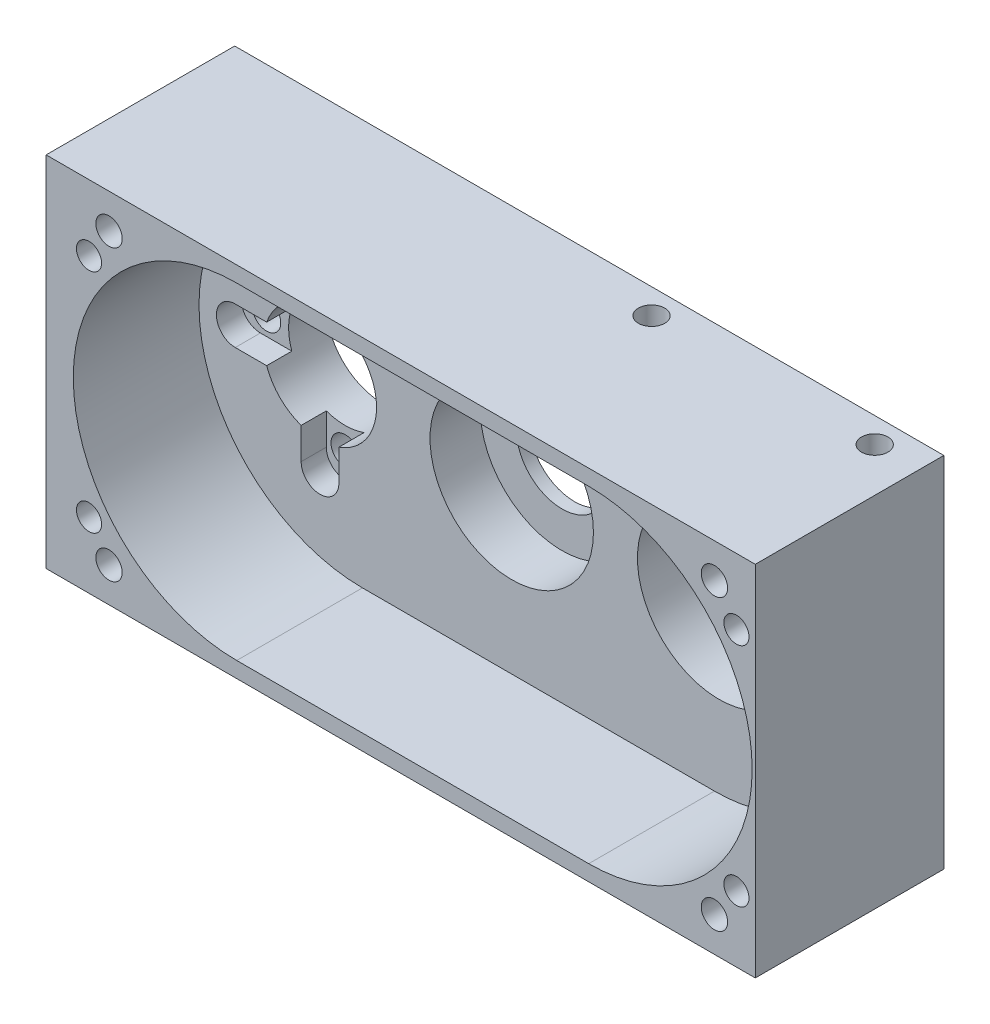
from build123d import *

# Parameters (mm, degrees)
ESBO_O1_W                                   = 118
ESBO_O1_H                                   = 62
RESSALTO_EXTRUS_O1_DEPTH                    = 30
CORTE_EXTRUS_O1_DEPTH                       = 20
RESSALTO_EXTRUS_O2_START                    = 8
RESSALTO_EXTRUS_O2_DEPTH                    = 8
ESBO_O4_R                                   = 9
ESBO_O4_R_2                                 = 13
CORTE_EXTRUS_O2_DEPTH                       = 8
ESBO_O5_R                                   = 2
CORTE_EXTRUS_O3_DEPTH                       = 8
CORTE_EXTRUS_O4_DEPTH                       = 4
BROCA_DE_ROSQUEAR_PARA_TARRAXA_DE_M52_D     = 4.2
BROCA_DE_ROSQUEAR_PARA_TARRAXA_DE_M52_DEPTH = 13
BROCA_DE_ROSQUEAR_PARA_TARRAXA_DE_M52_TIP   = 1.2618073
FURO_COM_FOLGA_DE_M41_D                     = 4.5
ESBO_O17_W                                  = 118
ESBO_O17_H                                  = 62
ESBO_O17_W_2                                = 112.82
ESBO_O17_H_2                                = 57
CORTE_EXTRUS_O5_DEPTH                       = 77.560841819
BROCA_DE_ROSQUEAR_PARA_TARRAXA_DE_M54_D     = 4.2
BROCA_DE_ROSQUEAR_PARA_TARRAXA_DE_M54_DEPTH = 15
BROCA_DE_ROSQUEAR_PARA_TARRAXA_DE_M54_TIP   = 1.2618073
BROCA_DE_ROSQUEAR_PARA_TARRAXA_DE_M55_D     = 4.2
BROCA_DE_ROSQUEAR_PARA_TARRAXA_DE_M55_DEPTH = 15
BROCA_DE_ROSQUEAR_PARA_TARRAXA_DE_M55_TIP   = 1.2618073
ESBO_O25_R                                  = 9
CORTE_EXTRUS_O6_DEPTH                       = 69.29211155
BROCA_DE_ROSQUEAR_PARA_TARRAXA_DE_M56_D     = 4.2
BROCA_DE_ROSQUEAR_PARA_TARRAXA_DE_M56_DEPTH = 8
BROCA_DE_ROSQUEAR_PARA_TARRAXA_DE_M56_TIP   = 1.2618073
FURO_COM_FOLGA_DE_M51_D                     = 5.5
ESBO_O30_R                                  = 7.25
CORTE_EXTRUS_O9_DEPTH                       = 10


with BuildPart() as part:
    # Esboço1 → Ressalto-extrusão1 (new body)
    with BuildSketch(Plane.XY):
        with Locations((4.25, 0)):
            Rectangle(ESBO_O1_W, ESBO_O1_H)
    extrude(amount=RESSALTO_EXTRUS_O1_DEPTH)

    # Esboço2 → Corte-extrusão1 (cut)
    with BuildSketch(Plane.XY.offset(30)):
        with BuildLine():
            Line((-23.75, 26), (32.25, 26))
            ThreePointArc((32.25, 26), (58.25, 0), (32.25, -26))
            Line((32.25, -26), (-23.75, -26))
            ThreePointArc((-23.75, -26), (-49.75, 0), (-23.75, 26))
        make_face()
    extrude(amount=-CORTE_EXTRUS_O1_DEPTH, mode=Mode.SUBTRACT)

    # Esboço3 → Ressalto-extrusão2 (add)
    with BuildSketch(Plane.XY.offset(10).offset(RESSALTO_EXTRUS_O2_START)):
        with BuildLine():
            Line((51, 18.012148678), (51, -18.012148678))
            ThreePointArc((51, -18.012148678), (58.25, 0), (51, 18.012148678))
        make_face()
    extrude(amount=-RESSALTO_EXTRUS_O2_DEPTH)

    # Esboço4 → Corte-extrusão2 (cut)
    with BuildSketch(Plane.XY.offset(10)):
        with Locations((-30.5, 0)):
            Circle(ESBO_O4_R)
        Circle(ESBO_O4_R_2)
        with Locations((33, 0)):
            Circle(ESBO_O4_R_2)
    extrude(amount=-CORTE_EXTRUS_O2_DEPTH, mode=Mode.SUBTRACT)

    # Esboço5 → Corte-extrusão3 (cut)
    with BuildSketch(Plane.XY.offset(30)):
        with Locations((-47.25, 18)):
            Circle(ESBO_O5_R)
        with Locations((55.75, 18)):
            Circle(ESBO_O5_R)
        with Locations((55.75, -18)):
            Circle(ESBO_O5_R)
        with Locations((-47.25, -18)):
            Circle(ESBO_O5_R)
    extrude(amount=-CORTE_EXTRUS_O3_DEPTH, mode=Mode.SUBTRACT)

    # Esboço6 → Corte-extrusão4 (cut)
    with BuildSketch(Plane.XY.offset(10)):
        with BuildLine():
            Line((-38.985281374, 3), (-43.985281374, 3))
            ThreePointArc((-43.985281374, 3), (-46.985281374, 0), (-43.985281374, -3))
            Line((-43.985281374, -3), (-38.985281374, -3))
            Line((-38.985281374, -3), (-38.985281374, 3))
        make_face()
        with BuildLine():
            Line((-33.5, 8.485281374), (-27.5, 8.485281374))
            Line((-27.5, 8.485281374), (-27.5, 13.485281374))
            ThreePointArc((-27.5, 13.485281374), (-30.5, 16.485281374), (-33.5, 13.485281374))
            Line((-33.5, 13.485281374), (-33.5, 8.485281374))
        make_face()
        with BuildLine():
            Line((-33.5, -8.485281374), (-33.5, -13.485281374))
            ThreePointArc((-33.5, -13.485281374), (-30.5, -16.485281374), (-27.5, -13.485281374))
            Line((-27.5, -13.485281374), (-27.5, -8.485281374))
            Line((-27.5, -8.485281374), (-33.5, -8.485281374))
        make_face()
    extrude(amount=-CORTE_EXTRUS_O4_DEPTH, mode=Mode.SUBTRACT)

    # Broca de rosquear para tarraxa de M52
    with Locations(Plane.XY.offset(30)):
        with Locations((-44.07, 23), (-44.07, -23), (52.25, -23), (52.25, 23)):
            Hole(BROCA_DE_ROSQUEAR_PARA_TARRAXA_DE_M52_D / 2, depth=BROCA_DE_ROSQUEAR_PARA_TARRAXA_DE_M52_DEPTH)
            with Locations((0, 0, -(BROCA_DE_ROSQUEAR_PARA_TARRAXA_DE_M52_DEPTH + BROCA_DE_ROSQUEAR_PARA_TARRAXA_DE_M52_TIP / 2))):  # 118° drill point
                Cone(0, BROCA_DE_ROSQUEAR_PARA_TARRAXA_DE_M52_D / 2, BROCA_DE_ROSQUEAR_PARA_TARRAXA_DE_M52_TIP, mode=Mode.SUBTRACT)

    # Furo com folga de M41 (through all)
    with Locations(Plane.XY.offset(6)):
        with Locations((-30.5, -12.5), (-43, 0), (-30.5, 12.5)):
            Hole(FURO_COM_FOLGA_DE_M41_D / 2)

    # Esboço17 → Corte-extrusão5 (cut, through all)
    with BuildSketch(Plane.XY.offset(30)):
        with Locations((4.25, 0)):
            Rectangle(ESBO_O17_W, ESBO_O17_H)
        with Locations((2.34, 0)):
            Rectangle(ESBO_O17_W_2, ESBO_O17_H_2, mode=Mode.SUBTRACT)
    extrude(amount=-CORTE_EXTRUS_O5_DEPTH, mode=Mode.SUBTRACT)

    # Broca de rosquear para tarraxa de M54
    with Locations(Plane(origin=(0, -28.5, 0), x_dir=(-1, 0, 0), z_dir=(0, -1, 0))):
        with Locations((-51.75, -4), (-16.25, -4)):
            Hole(BROCA_DE_ROSQUEAR_PARA_TARRAXA_DE_M54_D / 2, depth=BROCA_DE_ROSQUEAR_PARA_TARRAXA_DE_M54_DEPTH)
            with Locations((0, 0, -(BROCA_DE_ROSQUEAR_PARA_TARRAXA_DE_M54_DEPTH + BROCA_DE_ROSQUEAR_PARA_TARRAXA_DE_M54_TIP / 2))):  # 118° drill point
                Cone(0, BROCA_DE_ROSQUEAR_PARA_TARRAXA_DE_M54_D / 2, BROCA_DE_ROSQUEAR_PARA_TARRAXA_DE_M54_TIP, mode=Mode.SUBTRACT)

    # Broca de rosquear para tarraxa de M55
    with Locations(Plane(origin=(0, 28.5, 0), x_dir=(1, 0, 0), z_dir=(0, 1, 0))):
        with Locations((51.75, -4), (16.25, -4)):
            Hole(BROCA_DE_ROSQUEAR_PARA_TARRAXA_DE_M55_D / 2, depth=BROCA_DE_ROSQUEAR_PARA_TARRAXA_DE_M55_DEPTH)
            with Locations((0, 0, -(BROCA_DE_ROSQUEAR_PARA_TARRAXA_DE_M55_DEPTH + BROCA_DE_ROSQUEAR_PARA_TARRAXA_DE_M55_TIP / 2))):  # 118° drill point
                Cone(0, BROCA_DE_ROSQUEAR_PARA_TARRAXA_DE_M55_D / 2, BROCA_DE_ROSQUEAR_PARA_TARRAXA_DE_M55_TIP, mode=Mode.SUBTRACT)

    # Esboço25 → Corte-extrusão6 (cut, through all)
    with BuildSketch(Plane.XY.offset(10)):
        with Locations((-30.5, 0)):
            Circle(ESBO_O25_R)
    extrude(amount=-CORTE_EXTRUS_O6_DEPTH, mode=Mode.SUBTRACT)

    # Broca de rosquear para tarraxa de M56
    with Locations(Plane(origin=(0, 0, 0), x_dir=(-1, 0, 0), z_dir=(0, 0, -1))):
        with Locations((47.123, 21.276), (47.123, -21.276), (13.877, -21.28), (13.877, 21.28)):
            Hole(BROCA_DE_ROSQUEAR_PARA_TARRAXA_DE_M56_D / 2, depth=BROCA_DE_ROSQUEAR_PARA_TARRAXA_DE_M56_DEPTH)
            with Locations((0, 0, -(BROCA_DE_ROSQUEAR_PARA_TARRAXA_DE_M56_DEPTH + BROCA_DE_ROSQUEAR_PARA_TARRAXA_DE_M56_TIP / 2))):  # 118° drill point
                Cone(0, BROCA_DE_ROSQUEAR_PARA_TARRAXA_DE_M56_D / 2, BROCA_DE_ROSQUEAR_PARA_TARRAXA_DE_M56_TIP, mode=Mode.SUBTRACT)

    # Furo com folga de M51 (through all)
    with Locations(Plane.XY.offset(2)):
        with Locations((33, 0)):
            Hole(FURO_COM_FOLGA_DE_M51_D / 2)

    # Esboço30 → Corte-extrusão9 (cut)
    with BuildSketch(Plane.XY.offset(2)):
        Circle(ESBO_O30_R)
    extrude(amount=-CORTE_EXTRUS_O9_DEPTH, mode=Mode.SUBTRACT)


solid = part.part
